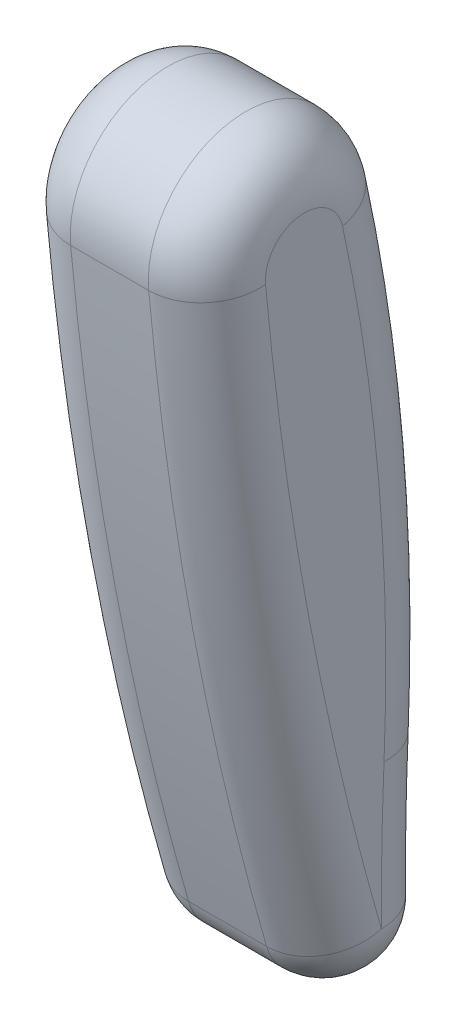
from build123d import *

# Parameters (mm, degrees)
BASE_EXTRUDE_DEPTH = 63.5
FILLET1_R          = 38.1


with BuildPart() as part:
    # Sketch7 → Base-Extrude (new, symmetric)
    with BuildSketch(Plane(origin=(114.3, 0, 0), x_dir=(0, 0, -1), z_dir=(1, 0, 0))):
        with BuildLine():
            ThreePointArc((37.885471858, -742.213802936), (-33.838948323, -692.9538134), (-87.396251362, -761.528986099))
            ThreePointArc((-87.396251362, -761.528986099), (-58.651901192, -967.339401786), (-10.701792985, -1169.539678727))
            ThreePointArc((-10.701792985, -1169.539678727), (31.347433103, -1196.725838045), (64.014969584, -1158.777758602))
            ThreePointArc((64.014969584, -1158.777758602), (64.297743258, -1113.02154154), (65.715717531, -1067.286426914))
            ThreePointArc((65.715717531, -1067.286426914), (62.282866841, -903.852702509), (37.885471858, -742.213802936))
        make_face()
    extrude(amount=BASE_EXTRUDE_DEPTH, both=True)

    # Fillet1
    fillet1_edges = [part.edges().sort_by_distance(p)[0] for p in [
        (50.8, -903.852702509, -62.282866841),
        (177.8, -903.852702509, -62.282866841),
        (50.8, -1113.02154154, -64.297743258),
        (177.8, -1113.02154154, -64.297743258),
        (50.8, -1196.725838045, -31.347433103),
        (177.8, -1196.725838045, -31.347433103),
        (50.8, -967.339401786, 58.651901192),
        (177.8, -967.339401786, 58.651901192),
        (177.8, -692.9538134, 33.838948323),
        (50.8, -692.9538134, 33.838948323),
    ]]
    fillet(fillet1_edges, radius=FILLET1_R)


solid = part.part
